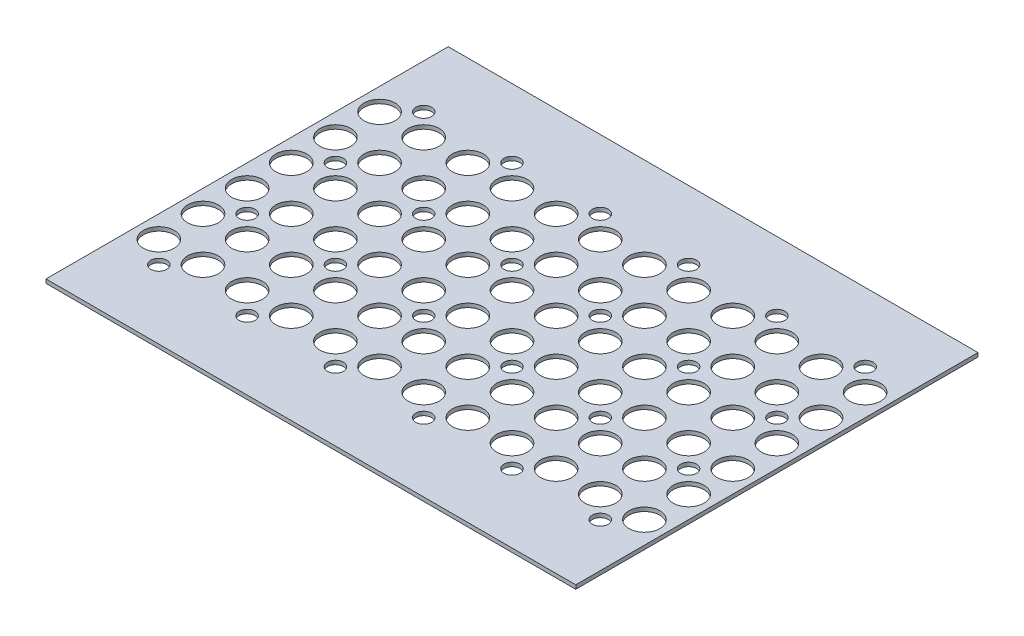
from build123d import *

# Parameters (mm, degrees)
SKETCH1_W           = 108
SKETCH1_H           = 82
SKETCH1_R           = 1.625
SKETCH1_R_2         = 3.15
BOSS_EXTRUDE1_DEPTH = 0.79375


with BuildPart() as part:
    # Sketch1 → Boss-Extrude1 (new body)
    with BuildSketch(Plane(origin=(0, 0, 0), x_dir=(1, 0, 0), z_dir=(0, 1, 0))):
        with Locations((0, 2.515945223)):
            Rectangle(SKETCH1_W, SKETCH1_H)
        with Locations(Location((-45, 29.515945223, 0), (0, 0, 270))):
            Circle(SKETCH1_R, mode=Mode.SUBTRACT)
        with Locations(Location((-49.5, 25.015945223, 0), (0, 0, 270))):
            Circle(SKETCH1_R_2, mode=Mode.SUBTRACT)
        with Locations(Location((-27, 29.515945223, 0), (0, 0, 270))):
            Circle(SKETCH1_R, mode=Mode.SUBTRACT)
        with Locations(Location((-9, 29.515945223, 0), (0, 0, 270))):
            Circle(SKETCH1_R, mode=Mode.SUBTRACT)
        with Locations(Location((9, 29.515945223, 0), (0, 0, 270))):
            Circle(SKETCH1_R, mode=Mode.SUBTRACT)
        with Locations(Location((27, 29.515945223, 0), (0, 0, 270))):
            Circle(SKETCH1_R, mode=Mode.SUBTRACT)
        with Locations(Location((45, 29.515945223, 0), (0, 0, 270))):
            Circle(SKETCH1_R, mode=Mode.SUBTRACT)
        with Locations(Location((-27, 11.515945223, 0), (0, 0, 270))):
            Circle(SKETCH1_R, mode=Mode.SUBTRACT)
        with Locations(Location((-9, 11.515945223, 0), (0, 0, 270))):
            Circle(SKETCH1_R, mode=Mode.SUBTRACT)
        with Locations(Location((9, 11.515945223, 0), (0, 0, 270))):
            Circle(SKETCH1_R, mode=Mode.SUBTRACT)
        with Locations(Location((27, 11.515945223, 0), (0, 0, 270))):
            Circle(SKETCH1_R, mode=Mode.SUBTRACT)
        with Locations(Location((45, 11.515945223, 0), (0, 0, 270))):
            Circle(SKETCH1_R, mode=Mode.SUBTRACT)
        with Locations(Location((-27, -6.484054777, 0), (0, 0, 270))):
            Circle(SKETCH1_R, mode=Mode.SUBTRACT)
        with Locations(Location((-9, -6.484054777, 0), (0, 0, 270))):
            Circle(SKETCH1_R, mode=Mode.SUBTRACT)
        with Locations(Location((9, -6.484054777, 0), (0, 0, 270))):
            Circle(SKETCH1_R, mode=Mode.SUBTRACT)
        with Locations(Location((27, -6.484054777, 0), (0, 0, 270))):
            Circle(SKETCH1_R, mode=Mode.SUBTRACT)
        with Locations(Location((45, -6.484054777, 0), (0, 0, 270))):
            Circle(SKETCH1_R, mode=Mode.SUBTRACT)
        with Locations(Location((-27, -24.484054777, 0), (0, 0, 270))):
            Circle(SKETCH1_R, mode=Mode.SUBTRACT)
        with Locations(Location((-9, -24.484054777, 0), (0, 0, 270))):
            Circle(SKETCH1_R, mode=Mode.SUBTRACT)
        with Locations(Location((9, -24.484054777, 0), (0, 0, 270))):
            Circle(SKETCH1_R, mode=Mode.SUBTRACT)
        with Locations(Location((27, -24.484054777, 0), (0, 0, 270))):
            Circle(SKETCH1_R, mode=Mode.SUBTRACT)
        with Locations(Location((45, -24.484054777, 0), (0, 0, 270))):
            Circle(SKETCH1_R, mode=Mode.SUBTRACT)
        with Locations(Location((-45, 11.515945223, 0), (0, 0, 270))):
            Circle(SKETCH1_R, mode=Mode.SUBTRACT)
        with Locations(Location((-45, -6.484054777, 0), (0, 0, 270))):
            Circle(SKETCH1_R, mode=Mode.SUBTRACT)
        with Locations(Location((-45, -24.484054777, 0), (0, 0, 270))):
            Circle(SKETCH1_R, mode=Mode.SUBTRACT)
        with Locations(Location((-40.5, 25.015945223, 0), (0, 0, 270))):
            Circle(SKETCH1_R_2, mode=Mode.SUBTRACT)
        with Locations(Location((-31.5, 25.015945223, 0), (0, 0, 270))):
            Circle(SKETCH1_R_2, mode=Mode.SUBTRACT)
        with Locations(Location((-22.5, 25.015945223, 0), (0, 0, 270))):
            Circle(SKETCH1_R_2, mode=Mode.SUBTRACT)
        with Locations(Location((-13.5, 25.015945223, 0), (0, 0, 270))):
            Circle(SKETCH1_R_2, mode=Mode.SUBTRACT)
        with Locations(Location((-4.5, 25.015945223, 0), (0, 0, 270))):
            Circle(SKETCH1_R_2, mode=Mode.SUBTRACT)
        with Locations(Location((4.5, 25.015945223, 0), (0, 0, 270))):
            Circle(SKETCH1_R_2, mode=Mode.SUBTRACT)
        with Locations(Location((13.5, 25.015945223, 0), (0, 0, 270))):
            Circle(SKETCH1_R_2, mode=Mode.SUBTRACT)
        with Locations(Location((22.5, 25.015945223, 0), (0, 0, 270))):
            Circle(SKETCH1_R_2, mode=Mode.SUBTRACT)
        with Locations(Location((31.5, 25.015945223, 0), (0, 0, 270))):
            Circle(SKETCH1_R_2, mode=Mode.SUBTRACT)
        with Locations(Location((40.5, 25.015945223, 0), (0, 0, 270))):
            Circle(SKETCH1_R_2, mode=Mode.SUBTRACT)
        with Locations(Location((49.5, 25.015945223, 0), (0, 0, 270))):
            Circle(SKETCH1_R_2, mode=Mode.SUBTRACT)
        with Locations(Location((-40.5, 16.015945223, 0), (0, 0, 270))):
            Circle(SKETCH1_R_2, mode=Mode.SUBTRACT)
        with Locations(Location((-31.5, 16.015945223, 0), (0, 0, 270))):
            Circle(SKETCH1_R_2, mode=Mode.SUBTRACT)
        with Locations(Location((-22.5, 16.015945223, 0), (0, 0, 270))):
            Circle(SKETCH1_R_2, mode=Mode.SUBTRACT)
        with Locations(Location((-13.5, 16.015945223, 0), (0, 0, 270))):
            Circle(SKETCH1_R_2, mode=Mode.SUBTRACT)
        with Locations(Location((-4.5, 16.015945223, 0), (0, 0, 270))):
            Circle(SKETCH1_R_2, mode=Mode.SUBTRACT)
        with Locations(Location((4.5, 16.015945223, 0), (0, 0, 270))):
            Circle(SKETCH1_R_2, mode=Mode.SUBTRACT)
        with Locations(Location((13.5, 16.015945223, 0), (0, 0, 270))):
            Circle(SKETCH1_R_2, mode=Mode.SUBTRACT)
        with Locations(Location((22.5, 16.015945223, 0), (0, 0, 270))):
            Circle(SKETCH1_R_2, mode=Mode.SUBTRACT)
        with Locations(Location((31.5, 16.015945223, 0), (0, 0, 270))):
            Circle(SKETCH1_R_2, mode=Mode.SUBTRACT)
        with Locations(Location((40.5, 16.015945223, 0), (0, 0, 270))):
            Circle(SKETCH1_R_2, mode=Mode.SUBTRACT)
        with Locations(Location((49.5, 16.015945223, 0), (0, 0, 270))):
            Circle(SKETCH1_R_2, mode=Mode.SUBTRACT)
        with Locations(Location((-40.5, 7.015945223, 0), (0, 0, 270))):
            Circle(SKETCH1_R_2, mode=Mode.SUBTRACT)
        with Locations(Location((-31.5, 7.015945223, 0), (0, 0, 270))):
            Circle(SKETCH1_R_2, mode=Mode.SUBTRACT)
        with Locations(Location((-22.5, 7.015945223, 0), (0, 0, 270))):
            Circle(SKETCH1_R_2, mode=Mode.SUBTRACT)
        with Locations(Location((-13.5, 7.015945223, 0), (0, 0, 270))):
            Circle(SKETCH1_R_2, mode=Mode.SUBTRACT)
        with Locations(Location((-4.5, 7.015945223, 0), (0, 0, 270))):
            Circle(SKETCH1_R_2, mode=Mode.SUBTRACT)
        with Locations(Location((4.5, 7.015945223, 0), (0, 0, 270))):
            Circle(SKETCH1_R_2, mode=Mode.SUBTRACT)
        with Locations(Location((13.5, 7.015945223, 0), (0, 0, 270))):
            Circle(SKETCH1_R_2, mode=Mode.SUBTRACT)
        with Locations(Location((22.5, 7.015945223, 0), (0, 0, 270))):
            Circle(SKETCH1_R_2, mode=Mode.SUBTRACT)
        with Locations(Location((31.5, 7.015945223, 0), (0, 0, 270))):
            Circle(SKETCH1_R_2, mode=Mode.SUBTRACT)
        with Locations(Location((40.5, 7.015945223, 0), (0, 0, 270))):
            Circle(SKETCH1_R_2, mode=Mode.SUBTRACT)
        with Locations(Location((49.5, 7.015945223, 0), (0, 0, 270))):
            Circle(SKETCH1_R_2, mode=Mode.SUBTRACT)
        with Locations(Location((-40.5, -1.984054777, 0), (0, 0, 270))):
            Circle(SKETCH1_R_2, mode=Mode.SUBTRACT)
        with Locations(Location((-31.5, -1.984054777, 0), (0, 0, 270))):
            Circle(SKETCH1_R_2, mode=Mode.SUBTRACT)
        with Locations(Location((-22.5, -1.984054777, 0), (0, 0, 270))):
            Circle(SKETCH1_R_2, mode=Mode.SUBTRACT)
        with Locations(Location((-13.5, -1.984054777, 0), (0, 0, 270))):
            Circle(SKETCH1_R_2, mode=Mode.SUBTRACT)
        with Locations(Location((-4.5, -1.984054777, 0), (0, 0, 270))):
            Circle(SKETCH1_R_2, mode=Mode.SUBTRACT)
        with Locations(Location((4.5, -1.984054777, 0), (0, 0, 270))):
            Circle(SKETCH1_R_2, mode=Mode.SUBTRACT)
        with Locations(Location((13.5, -1.984054777, 0), (0, 0, 270))):
            Circle(SKETCH1_R_2, mode=Mode.SUBTRACT)
        with Locations(Location((22.5, -1.984054777, 0), (0, 0, 270))):
            Circle(SKETCH1_R_2, mode=Mode.SUBTRACT)
        with Locations(Location((31.5, -1.984054777, 0), (0, 0, 270))):
            Circle(SKETCH1_R_2, mode=Mode.SUBTRACT)
        with Locations(Location((40.5, -1.984054777, 0), (0, 0, 270))):
            Circle(SKETCH1_R_2, mode=Mode.SUBTRACT)
        with Locations(Location((49.5, -1.984054777, 0), (0, 0, 270))):
            Circle(SKETCH1_R_2, mode=Mode.SUBTRACT)
        with Locations(Location((-40.5, -10.984054777, 0), (0, 0, 270))):
            Circle(SKETCH1_R_2, mode=Mode.SUBTRACT)
        with Locations(Location((-31.5, -10.984054777, 0), (0, 0, 270))):
            Circle(SKETCH1_R_2, mode=Mode.SUBTRACT)
        with Locations(Location((-22.5, -10.984054777, 0), (0, 0, 270))):
            Circle(SKETCH1_R_2, mode=Mode.SUBTRACT)
        with Locations(Location((-13.5, -10.984054777, 0), (0, 0, 270))):
            Circle(SKETCH1_R_2, mode=Mode.SUBTRACT)
        with Locations(Location((-4.5, -10.984054777, 0), (0, 0, 270))):
            Circle(SKETCH1_R_2, mode=Mode.SUBTRACT)
        with Locations(Location((4.5, -10.984054777, 0), (0, 0, 270))):
            Circle(SKETCH1_R_2, mode=Mode.SUBTRACT)
        with Locations(Location((13.5, -10.984054777, 0), (0, 0, 270))):
            Circle(SKETCH1_R_2, mode=Mode.SUBTRACT)
        with Locations(Location((22.5, -10.984054777, 0), (0, 0, 270))):
            Circle(SKETCH1_R_2, mode=Mode.SUBTRACT)
        with Locations(Location((31.5, -10.984054777, 0), (0, 0, 270))):
            Circle(SKETCH1_R_2, mode=Mode.SUBTRACT)
        with Locations(Location((40.5, -10.984054777, 0), (0, 0, 270))):
            Circle(SKETCH1_R_2, mode=Mode.SUBTRACT)
        with Locations(Location((49.5, -10.984054777, 0), (0, 0, 270))):
            Circle(SKETCH1_R_2, mode=Mode.SUBTRACT)
        with Locations(Location((-40.5, -19.984054777, 0), (0, 0, 270))):
            Circle(SKETCH1_R_2, mode=Mode.SUBTRACT)
        with Locations(Location((-31.5, -19.984054777, 0), (0, 0, 270))):
            Circle(SKETCH1_R_2, mode=Mode.SUBTRACT)
        with Locations(Location((-22.5, -19.984054777, 0), (0, 0, 270))):
            Circle(SKETCH1_R_2, mode=Mode.SUBTRACT)
        with Locations(Location((-13.5, -19.984054777, 0), (0, 0, 270))):
            Circle(SKETCH1_R_2, mode=Mode.SUBTRACT)
        with Locations(Location((-4.5, -19.984054777, 0), (0, 0, 270))):
            Circle(SKETCH1_R_2, mode=Mode.SUBTRACT)
        with Locations(Location((4.5, -19.984054777, 0), (0, 0, 270))):
            Circle(SKETCH1_R_2, mode=Mode.SUBTRACT)
        with Locations(Location((13.5, -19.984054777, 0), (0, 0, 270))):
            Circle(SKETCH1_R_2, mode=Mode.SUBTRACT)
        with Locations(Location((22.5, -19.984054777, 0), (0, 0, 270))):
            Circle(SKETCH1_R_2, mode=Mode.SUBTRACT)
        with Locations(Location((31.5, -19.984054777, 0), (0, 0, 270))):
            Circle(SKETCH1_R_2, mode=Mode.SUBTRACT)
        with Locations(Location((40.5, -19.984054777, 0), (0, 0, 270))):
            Circle(SKETCH1_R_2, mode=Mode.SUBTRACT)
        with Locations(Location((49.5, -19.984054777, 0), (0, 0, 270))):
            Circle(SKETCH1_R_2, mode=Mode.SUBTRACT)
        with Locations(Location((-49.5, 16.015945223, 0), (0, 0, 270))):
            Circle(SKETCH1_R_2, mode=Mode.SUBTRACT)
        with Locations(Location((-49.5, 7.015945223, 0), (0, 0, 270))):
            Circle(SKETCH1_R_2, mode=Mode.SUBTRACT)
        with Locations(Location((-49.5, -1.984054777, 0), (0, 0, 270))):
            Circle(SKETCH1_R_2, mode=Mode.SUBTRACT)
        with Locations(Location((-49.5, -10.984054777, 0), (0, 0, 270))):
            Circle(SKETCH1_R_2, mode=Mode.SUBTRACT)
        with Locations(Location((-49.5, -19.984054777, 0), (0, 0, 270))):
            Circle(SKETCH1_R_2, mode=Mode.SUBTRACT)
    extrude(amount=BOSS_EXTRUDE1_DEPTH)


solid = part.part
